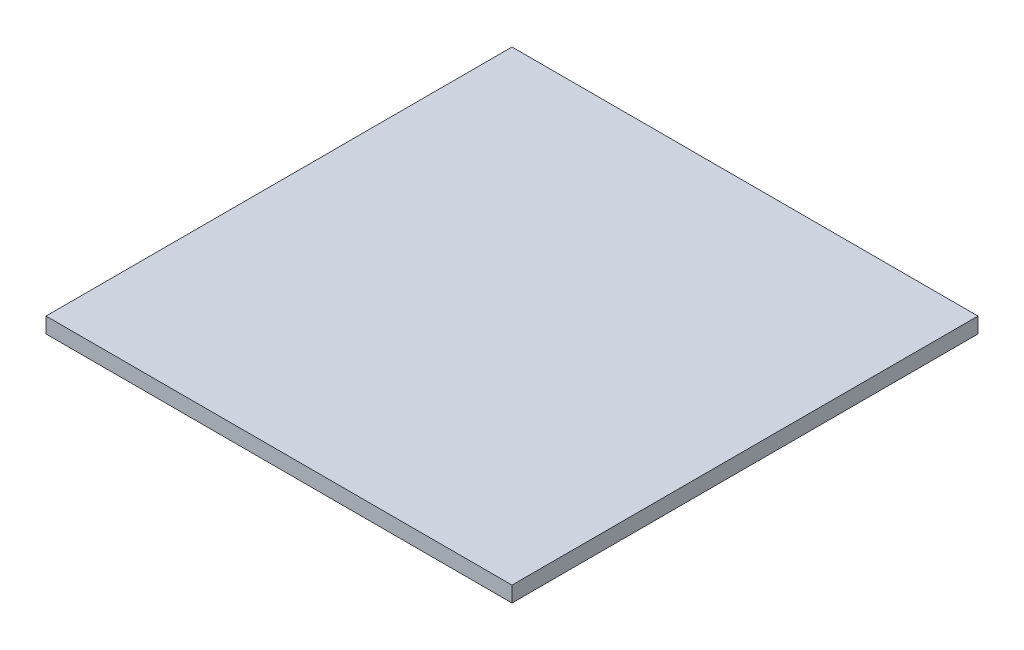
from build123d import *

# Parameters (mm, degrees)
SKETCH1_W           = 76.2
SKETCH1_H           = 76.2
BOSS_EXTRUDE1_DEPTH = 2.54


with BuildPart() as part:
    # Sketch1 → Boss-Extrude1 (new body)
    with BuildSketch(Plane(origin=(0, 0, 0), x_dir=(1, 0, 0), z_dir=(0, 1, 0))):
        with Locations((38.1, 38.1)):
            Rectangle(SKETCH1_W, SKETCH1_H)
    extrude(amount=BOSS_EXTRUDE1_DEPTH)


solid = part.part
